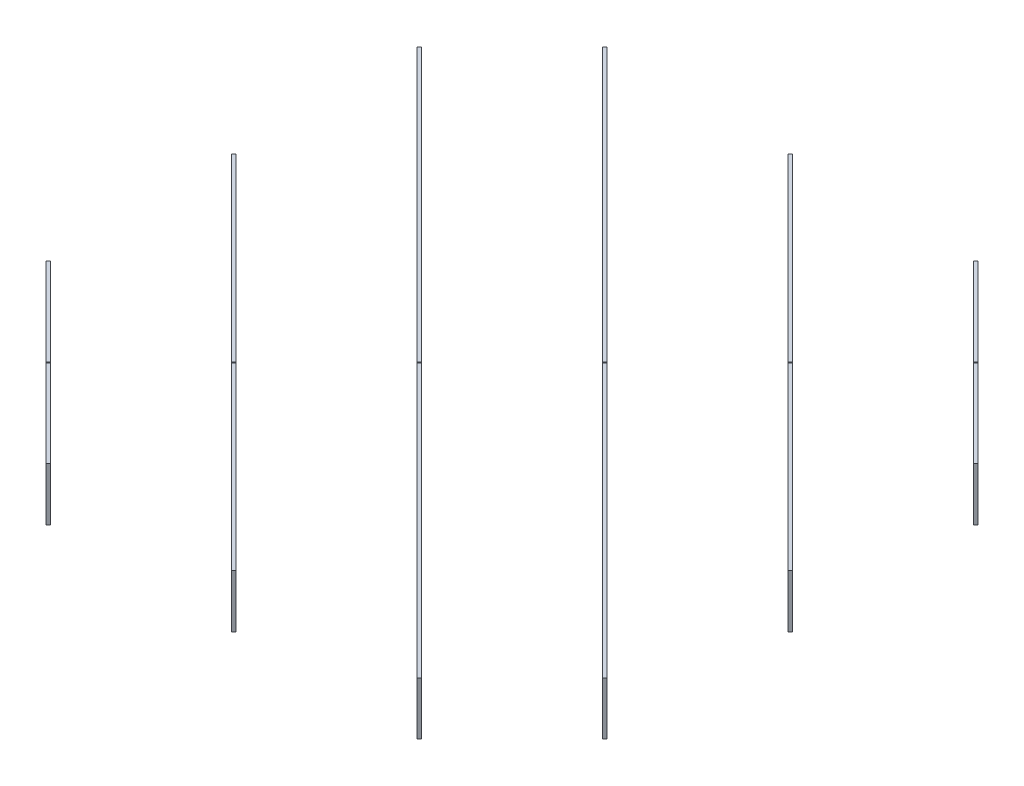
from build123d import *

# Parameters (mm, degrees)
BOSS_EXTRUDE1_DEPTH   = 100
BOSS_EXTRUDE1_2_DEPTH = 100
BOSS_EXTRUDE1_3_DEPTH = 100
BOSS_EXTRUDE1_4_DEPTH = 100
BOSS_EXTRUDE1_5_DEPTH = 100
BOSS_EXTRUDE1_6_DEPTH = 100
SKETCH3_R             = 1.5
SKETCH3_W             = 6
SKETCH3_H             = 100
CUT_EXTRUDE1_DEPTH    = 1481.698283187
SKETCH4_W             = 56
SKETCH4_H             = 12
CUT_EXTRUDE2_DEPTH    = 6
SKETCH5_W             = 56
SKETCH5_H             = 12
CUT_EXTRUDE3_DEPTH    = 6
SKETCH6_R             = 1.5
CUT_EXTRUDE4_DEPTH    = 1481.698283187
CUT_EXTRUDE5_START    = -253.487374
SKETCH7_R             = 4
CUT_EXTRUDE5_DEPTH    = 253.487374
CUT_EXTRUDE6_START    = -253.487374
SKETCH8_R             = 3
CUT_EXTRUDE6_DEPTH    = 253.487374
SKETCH9_R             = 3
CUT_EXTRUDE7_DEPTH    = 253.487373415
CUT_EXTRUDE8_START    = -748.46212
SKETCH10_R            = 3
CUT_EXTRUDE8_DEPTH    = 748.46212
CUT_EXTRUDE9_START    = -253.487374
SKETCH11_R            = 3
CUT_EXTRUDE9_DEPTH    = 253.487374


with BuildPart() as part:
    # Sketch2 → Boss-Extrude1 (new body)
    with BuildSketch(Plane(origin=(0, 0, 0), x_dir=(1, 0, 0), z_dir=(0, 1, 0))):
        Polygon((-605, -274.242640687), (-274.242640687, -605), (-270, -600.757359313), (-600.757359313, -270), align=None)
    extrude(amount=BOSS_EXTRUDE1_DEPTH)


with BuildPart() as body_2:
    # Sketch2 → Boss-Extrude1 2 (new body)
    with BuildSketch(Plane(origin=(0, 0, 0), x_dir=(1, 0, 0), z_dir=(0, 1, 0))):
        Polygon((-605, 75.757359313), (75.757359313, -605), (80, -600.757359313), (-600.757359313, 80), align=None)
    extrude(amount=BOSS_EXTRUDE1_2_DEPTH)


with BuildPart() as body_3:
    # Sketch2 → Boss-Extrude1 3 (new body)
    with BuildSketch(Plane(origin=(0, 0, 0), x_dir=(1, 0, 0), z_dir=(0, 1, 0))):
        Polygon((-605, 425.757359313), (425.757359313, -605), (430, -600.757359313), (-600.757359313, 430), align=None)
    extrude(amount=BOSS_EXTRUDE1_3_DEPTH)


with BuildPart() as body_4:
    # Sketch2 → Boss-Extrude1 4 (new body)
    with BuildSketch(Plane(origin=(0, 0, 0), x_dir=(1, 0, 0), z_dir=(0, 1, 0))):
        Polygon((-430, 600.757359313), (600.757359313, -430), (605, -425.757359313), (-425.757359313, 605), align=None)
    extrude(amount=BOSS_EXTRUDE1_4_DEPTH)


with BuildPart() as body_5:
    # Sketch2 → Boss-Extrude1 5 (new body)
    with BuildSketch(Plane(origin=(0, 0, 0), x_dir=(1, 0, 0), z_dir=(0, 1, 0))):
        Polygon((-80, 600.757359313), (600.757359313, -80), (605, -75.757359313), (-75.757359313, 605), align=None)
    extrude(amount=BOSS_EXTRUDE1_5_DEPTH)


with BuildPart() as body_6:
    # Sketch2 → Boss-Extrude1 6 (new body)
    with BuildSketch(Plane(origin=(0, 0, 0), x_dir=(1, 0, 0), z_dir=(0, 1, 0))):
        Polygon((270, 600.757359313), (600.757359313, 270), (605, 274.242640687), (274.242640687, 605), align=None)
    extrude(amount=BOSS_EXTRUDE1_6_DEPTH)


with BuildPart() as cut_extrude1_tool:
    # Sketch3 → Cut-Extrude1 (new, through all)
    with BuildSketch(Plane(origin=(-439.621320344, 0, 439.621320344), x_dir=(0.7071067811865451, 0, 0.70710678118655), z_dir=(-0.70710678118655, 0, 0.7071067811865451))):
        with Locations((-615.718433538, 50)):
            Circle(SKETCH3_R)
        with Locations((-621.718433538, 50)):
            Circle(SKETCH3_R)
        with Locations((-618.718433538, 0)):
            Rectangle(SKETCH3_W, SKETCH3_H)
        with BuildLine():
            Line((-621.718433538, 48.5), (-621.718433538, 50))
            Line((-621.718433538, 50), (-620.218433538, 50))
            ThreePointArc((-620.218433538, 50), (-622.77909371, 51.060660172), (-621.718433538, 48.5))
        make_face()
        with BuildLine():
            Line((-620.218433538, 50), (-621.718433538, 50))
            Line((-621.718433538, 50), (-621.718433538, 48.5))
            ThreePointArc((-621.718433538, 48.5), (-620.657773366, 48.939339828), (-620.218433538, 50))
        make_face()
        with BuildLine():
            ThreePointArc((-614.218433538, 50), (-615.718433538, 51.5), (-617.218433538, 50))
            Line((-617.218433538, 50), (-615.718433538, 50))
            Line((-615.718433538, 50), (-615.718433538, 48.5))
            ThreePointArc((-615.718433538, 48.5), (-614.657773366, 48.939339828), (-614.218433538, 50))
        make_face()
        with BuildLine():
            Line((-615.718433538, 50), (-617.218433538, 50))
            ThreePointArc((-617.218433538, 50), (-616.77909371, 48.939339828), (-615.718433538, 48.5))
            Line((-615.718433538, 48.5), (-615.718433538, 50))
        make_face()
        with BuildLine():
            Line((-374.231060123, 48.5), (-374.231060123, 50))
            Line((-374.231060123, 50), (-372.731060123, 50))
            ThreePointArc((-372.731060123, 50), (-375.291720295, 51.060660172), (-374.231060123, 48.5))
        make_face()
        with BuildLine():
            Line((-372.731060123, 50), (-374.231060123, 50))
            Line((-374.231060123, 50), (-374.231060123, 48.5))
            ThreePointArc((-374.231060123, 48.5), (-373.170399951, 48.939339828), (-372.731060123, 50))
        make_face()
        with Locations((-368.231060123, 50)):
            Circle(SKETCH3_R)
        with Locations((-374.231060123, 50)):
            Circle(SKETCH3_R)
        with Locations((-371.231060123, 0)):
            Rectangle(SKETCH3_W, SKETCH3_H)
        with BuildLine():
            ThreePointArc((-366.731060123, 50), (-368.231060123, 51.5), (-369.731060123, 50))
            Line((-369.731060123, 50), (-368.231060123, 50))
            Line((-368.231060123, 50), (-368.231060123, 48.5))
            ThreePointArc((-368.231060123, 48.5), (-367.170399951, 48.939339828), (-366.731060123, 50))
        make_face()
        with BuildLine():
            Line((-368.231060123, 50), (-369.731060123, 50))
            ThreePointArc((-369.731060123, 50), (-369.291720295, 48.939339828), (-368.231060123, 48.5))
            Line((-368.231060123, 48.5), (-368.231060123, 50))
        make_face()
        with BuildLine():
            Line((-126.705577884, 48.5), (-126.705577884, 50))
            Line((-126.705577884, 50), (-125.205577884, 50))
            ThreePointArc((-125.205577884, 50), (-127.766238056, 51.060660172), (-126.705577884, 48.5))
        make_face()
        with BuildLine():
            Line((-125.205577884, 50), (-126.705577884, 50))
            Line((-126.705577884, 50), (-126.705577884, 48.5))
            ThreePointArc((-126.705577884, 48.5), (-125.644917713, 48.939339828), (-125.205577884, 50))
        make_face()
        with BuildLine():
            ThreePointArc((-119.205577884, 50), (-120.705577884, 51.5), (-122.205577884, 50))
            Line((-122.205577884, 50), (-120.705577884, 50))
            Line((-120.705577884, 50), (-120.705577884, 48.5))
            ThreePointArc((-120.705577884, 48.5), (-119.644917713, 48.939339828), (-119.205577884, 50))
        make_face()
        with BuildLine():
            Line((-120.705577884, 50), (-122.205577884, 50))
            ThreePointArc((-122.205577884, 50), (-121.766238056, 48.939339828), (-120.705577884, 48.5))
            Line((-120.705577884, 48.5), (-120.705577884, 50))
        make_face()
        with BuildLine():
            Line((-122.205577884, 50), (-125.205577884, 50))
            ThreePointArc((-125.205577884, 50), (-125.644917713, 48.939339828), (-126.705577884, 48.5))
            Line((-126.705577884, 48.5), (-126.705577884, 0))
            Line((-126.705577884, 0), (-120.705577884, 0))
            Line((-120.705577884, 0), (-120.705577884, 48.5))
            ThreePointArc((-120.705577884, 48.5), (-121.766238056, 48.939339828), (-122.205577884, 50))
        make_face()
        with BuildLine():
            ThreePointArc((122.205577884, 50), (119.644917713, 51.060660172), (120.705577884, 48.5))
            Line((120.705577884, 48.5), (120.705577884, 50))
            Line((120.705577884, 50), (122.205577884, 50))
        make_face()
        with BuildLine():
            Line((120.705577884, 50), (120.705577884, 48.5))
            ThreePointArc((120.705577884, 48.5), (121.766238056, 48.939339828), (122.205577884, 50))
            Line((122.205577884, 50), (120.705577884, 50))
        make_face()
        with BuildLine():
            Line((120.705577884, 48.5), (120.705577884, 0))
            Line((120.705577884, 0), (126.705577884, 0))
            Line((126.705577884, 0), (126.705577884, 48.5))
            ThreePointArc((126.705577884, 48.5), (125.644917713, 48.939339828), (125.205577884, 50))
            Line((125.205577884, 50), (122.205577884, 50))
            ThreePointArc((122.205577884, 50), (121.766238056, 48.939339828), (120.705577884, 48.5))
        make_face()
        with BuildLine():
            ThreePointArc((125.205577884, 50), (125.644917713, 48.939339828), (126.705577884, 48.5))
            Line((126.705577884, 48.5), (126.705577884, 50))
            Line((126.705577884, 50), (125.205577884, 50))
        make_face()
        with BuildLine():
            Line((126.705577884, 50), (126.705577884, 48.5))
            ThreePointArc((126.705577884, 48.5), (127.766238056, 48.939339828), (128.205577884, 50))
            ThreePointArc((128.205577884, 50), (126.705577884, 51.5), (125.205577884, 50))
            Line((125.205577884, 50), (126.705577884, 50))
        make_face()
        with BuildLine():
            Line((369.731060123, 50), (368.231060123, 50))
            Line((368.231060123, 50), (368.231060123, 48.5))
            ThreePointArc((368.231060123, 48.5), (369.291720295, 48.939339828), (369.731060123, 50))
        make_face()
        with BuildLine():
            Line((368.231060123, 48.5), (368.231060123, 50))
            Line((368.231060123, 50), (369.731060123, 50))
            ThreePointArc((369.731060123, 50), (367.170399951, 51.060660172), (368.231060123, 48.5))
        make_face()
        with Locations((374.231060123, 50)):
            Circle(SKETCH3_R)
        with Locations((368.231060123, 50)):
            Circle(SKETCH3_R)
        with Locations((371.231060123, 0)):
            Rectangle(SKETCH3_W, SKETCH3_H)
        with BuildLine():
            ThreePointArc((375.731060123, 50), (374.231060123, 51.5), (372.731060123, 50))
            Line((372.731060123, 50), (374.231060123, 50))
            Line((374.231060123, 50), (374.231060123, 48.5))
            ThreePointArc((374.231060123, 48.5), (375.291720295, 48.939339828), (375.731060123, 50))
        make_face()
        with BuildLine():
            Line((374.231060123, 50), (372.731060123, 50))
            ThreePointArc((372.731060123, 50), (373.170399951, 48.939339828), (374.231060123, 48.5))
            Line((374.231060123, 48.5), (374.231060123, 50))
        make_face()
        with BuildLine():
            Line((617.218433538, 50), (615.718433538, 50))
            Line((615.718433538, 50), (615.718433538, 48.5))
            ThreePointArc((615.718433538, 48.5), (616.77909371, 48.939339828), (617.218433538, 50))
        make_face()
        with BuildLine():
            Line((615.718433538, 48.5), (615.718433538, 50))
            Line((615.718433538, 50), (617.218433538, 50))
            ThreePointArc((617.218433538, 50), (614.657773366, 51.060660172), (615.718433538, 48.5))
        make_face()
        with BuildLine():
            ThreePointArc((623.218433538, 50), (621.718433538, 51.5), (620.218433538, 50))
            Line((620.218433538, 50), (621.718433538, 50))
            Line((621.718433538, 50), (621.718433538, 48.5))
            ThreePointArc((621.718433538, 48.5), (622.77909371, 48.939339828), (623.218433538, 50))
        make_face()
        with BuildLine():
            Line((621.718433538, 50), (620.218433538, 50))
            ThreePointArc((620.218433538, 50), (620.657773366, 48.939339828), (621.718433538, 48.5))
            Line((621.718433538, 48.5), (621.718433538, 50))
        make_face()
        with Locations((621.718433538, 50)):
            Circle(SKETCH3_R)
        with Locations((615.718433538, 50)):
            Circle(SKETCH3_R)
        with Locations((618.718433538, 0)):
            Rectangle(SKETCH3_W, SKETCH3_H)
    extrude(amount=-CUT_EXTRUDE1_DEPTH)


with BuildPart() as part_1:
    add(part.part)

    # Cut-Extrude1: cut by cut_extrude1_tool
    add(cut_extrude1_tool.part, mode=Mode.SUBTRACT)


with BuildPart() as body_2_1:
    add(body_2.part)

    # Cut-Extrude1: cut by cut_extrude1_tool
    add(cut_extrude1_tool.part, mode=Mode.SUBTRACT)

    # Sketch5 → Cut-Extrude3 (cut)
    with BuildSketch(Plane(origin=(-264.621320344, 0, 264.621320344), x_dir=(0.7071067811865479, 0, 0.7071067811865472), z_dir=(-0.7071067811865472, 0, 0.7071067811865479))):
        with Locations((0.019054412, 22)):
            Rectangle(SKETCH5_W, SKETCH5_H)
    extrude(amount=-CUT_EXTRUDE3_DEPTH, mode=Mode.SUBTRACT)


with BuildPart() as body_3_1:
    add(body_3.part)

    # Cut-Extrude1: cut by cut_extrude1_tool
    add(cut_extrude1_tool.part, mode=Mode.SUBTRACT)


with BuildPart() as body_4_1:
    add(body_4.part)

    # Cut-Extrude1: cut by cut_extrude1_tool
    add(cut_extrude1_tool.part, mode=Mode.SUBTRACT)


with BuildPart() as body_5_1:
    add(body_5.part)

    # Cut-Extrude1: cut by cut_extrude1_tool
    add(cut_extrude1_tool.part, mode=Mode.SUBTRACT)

    # Sketch4 → Cut-Extrude2 (cut)
    with BuildSketch(Plane(origin=(260.378679656, 0, -260.378679656), x_dir=(0.7071067811865479, 0, 0.7071067811865472), z_dir=(-0.7071067811865472, 0, 0.7071067811865479))):
        with Locations((0.019054412, 22)):
            Rectangle(SKETCH4_W, SKETCH4_H)
    extrude(amount=-CUT_EXTRUDE2_DEPTH, mode=Mode.SUBTRACT)


with BuildPart() as body_6_1:
    add(body_6.part)

    # Cut-Extrude1: cut by cut_extrude1_tool
    add(cut_extrude1_tool.part, mode=Mode.SUBTRACT)


with BuildPart() as cut_extrude4_tool:
    # Sketch6 → Cut-Extrude4 (new, through all)
    with BuildSketch(Plane(origin=(-439.621320344, 0, 439.621320344), x_dir=(0.7071067811865468, 0, 0.7071067811865482), z_dir=(-0.7071067811865482, 0, 0.7071067811865468))):
        with Locations((0, 100)):
            Circle(SKETCH6_R)
    extrude(amount=-CUT_EXTRUDE4_DEPTH)


with BuildPart() as part_2:
    add(part_1.part)

    # Cut-Extrude4: cut by cut_extrude4_tool
    add(cut_extrude4_tool.part, mode=Mode.SUBTRACT)


with BuildPart() as body_2_2:
    add(body_2_1.part)

    # Cut-Extrude4: cut by cut_extrude4_tool
    add(cut_extrude4_tool.part, mode=Mode.SUBTRACT)


with BuildPart() as body_3_2:
    add(body_3_1.part)

    # Cut-Extrude4: cut by cut_extrude4_tool
    add(cut_extrude4_tool.part, mode=Mode.SUBTRACT)


with BuildPart() as body_4_2:
    add(body_4_1.part)

    # Cut-Extrude4: cut by cut_extrude4_tool
    add(cut_extrude4_tool.part, mode=Mode.SUBTRACT)


with BuildPart() as body_5_2:
    add(body_5_1.part)

    # Cut-Extrude4: cut by cut_extrude4_tool
    add(cut_extrude4_tool.part, mode=Mode.SUBTRACT)


with BuildPart() as body_6_2:
    add(body_6_1.part)

    # Cut-Extrude4: cut by cut_extrude4_tool
    add(cut_extrude4_tool.part, mode=Mode.SUBTRACT)


with BuildPart() as cut_extrude5_tool:
    # Sketch7 → Cut-Extrude5 (new body)
    with BuildSketch(Plane(origin=(-89.621320344, 0, 89.621320344), x_dir=(0.7071067811865432, 0, 0.7071067811865519), z_dir=(-0.7071067811865519, 0, 0.7071067811865432)).offset(CUT_EXTRUDE5_START)):
        with Locations((0, 84)):
            Circle(SKETCH7_R)
        with Locations((0, 64)):
            Circle(SKETCH7_R)
    extrude(amount=CUT_EXTRUDE5_DEPTH)


with BuildPart() as body_3_3:
    add(body_3_2.part)

    # Cut-Extrude5: cut by cut_extrude5_tool
    add(cut_extrude5_tool.part, mode=Mode.SUBTRACT)


with BuildPart() as body_4_3:
    add(body_4_2.part)

    # Cut-Extrude5: cut by cut_extrude5_tool
    add(cut_extrude5_tool.part, mode=Mode.SUBTRACT)


with BuildPart() as cut_extrude6_tool:
    # Sketch8 → Cut-Extrude6 (new body)
    with BuildSketch(Plane(origin=(-439.621320344, 0, 439.621320344), x_dir=(0.7071067811865468, 0, 0.7071067811865482), z_dir=(-0.7071067811865482, 0, 0.7071067811865468)).offset(CUT_EXTRUDE6_START)):
        with Locations((0, 50)):
            Circle(SKETCH8_R)
    extrude(amount=CUT_EXTRUDE6_DEPTH)


with BuildPart() as part_3:
    add(part_2.part)

    # Cut-Extrude6: cut by cut_extrude6_tool
    add(cut_extrude6_tool.part, mode=Mode.SUBTRACT)


with BuildPart() as body_2_3:
    add(body_2_2.part)

    # Cut-Extrude6: cut by cut_extrude6_tool
    add(cut_extrude6_tool.part, mode=Mode.SUBTRACT)


with BuildPart() as cut_extrude7_tool:
    # Sketch9 → Cut-Extrude7 (new body)
    with BuildSketch(Plane(origin=(439.621320344, 0, -439.621320344), x_dir=(-0.7071067811865479, 0, -0.7071067811865472), z_dir=(0.7071067811865472, 0, -0.7071067811865479))):
        with Locations((0, 50)):
            Circle(SKETCH9_R)
    extrude(amount=-CUT_EXTRUDE7_DEPTH)


with BuildPart() as body_5_3:
    add(body_5_2.part)

    # Cut-Extrude7: cut by cut_extrude7_tool
    add(cut_extrude7_tool.part, mode=Mode.SUBTRACT)


with BuildPart() as body_6_3:
    add(body_6_2.part)

    # Cut-Extrude7: cut by cut_extrude7_tool
    add(cut_extrude7_tool.part, mode=Mode.SUBTRACT)


with BuildPart() as cut_extrude8_tool:
    # Sketch10 → Cut-Extrude8 (new body)
    with BuildSketch(Plane(origin=(-264.621320344, 0, 264.621320344), x_dir=(0.7071067811865479, 0, 0.7071067811865472), z_dir=(-0.7071067811865472, 0, 0.7071067811865479)).offset(CUT_EXTRUDE8_START)):
        with Locations((-247.477846209, 50)):
            Circle(SKETCH10_R)
    cut_extrude8 = extrude(amount=CUT_EXTRUDE8_DEPTH)


with BuildPart() as body_2_4:
    add(body_2_3.part)

    # Cut-Extrude8: cut by cut_extrude8_tool
    add(cut_extrude8_tool.part, mode=Mode.SUBTRACT)


with BuildPart() as body_3_4:
    add(body_3_3.part)

    # Cut-Extrude8: cut by cut_extrude8_tool
    add(cut_extrude8_tool.part, mode=Mode.SUBTRACT)


with BuildPart() as body_4_4:
    add(body_4_3.part)

    # Cut-Extrude8: cut by cut_extrude8_tool
    add(cut_extrude8_tool.part, mode=Mode.SUBTRACT)


with BuildPart() as body_5_4:
    add(body_5_3.part)

    # Cut-Extrude8: cut by cut_extrude8_tool
    add(cut_extrude8_tool.part, mode=Mode.SUBTRACT)


with BuildPart() as cut_extrude9_tool:
    # Sketch11 → Cut-Extrude9 (new body)
    with BuildSketch(Plane(origin=(-89.621320344, 0, 89.621320344), x_dir=(0.7071067811865432, 0, 0.7071067811865519), z_dir=(-0.7071067811865519, 0, 0.7071067811865432)).offset(CUT_EXTRUDE9_START)):
        with Locations((-494.974746831, 50)):
            Circle(SKETCH11_R)
    cut_extrude9 = extrude(amount=CUT_EXTRUDE9_DEPTH)


with BuildPart() as body_3_5:
    add(body_3_4.part)

    # Cut-Extrude9: cut by cut_extrude9_tool
    add(cut_extrude9_tool.part, mode=Mode.SUBTRACT)


with BuildPart() as body_4_5:
    add(body_4_4.part)

    # Cut-Extrude9: cut by cut_extrude9_tool
    add(cut_extrude9_tool.part, mode=Mode.SUBTRACT)


with BuildPart() as mirror1_tool:
    # Mirror1: Cut-Extrude8, Cut-Extrude9 across plane
    add(cut_extrude8.mirror(Plane(origin=(0, 0, 0), x_dir=(-0.7071067811865472, 0, 0.7071067811865479), z_dir=(-0.7071067811865478, 0, -0.7071067811865472))))
    add(cut_extrude9.mirror(Plane(origin=(0, 0, 0), x_dir=(-0.7071067811865472, 0, 0.7071067811865479), z_dir=(-0.7071067811865478, 0, -0.7071067811865472))))


with BuildPart() as body_2_5:
    add(body_2_4.part)

    # Mirror1: cut by mirror1_tool
    add(mirror1_tool.part, mode=Mode.SUBTRACT)


with BuildPart() as body_3_6:
    add(body_3_5.part)

    # Mirror1: cut by mirror1_tool
    add(mirror1_tool.part, mode=Mode.SUBTRACT)


with BuildPart() as body_4_6:
    add(body_4_5.part)

    # Mirror1: cut by mirror1_tool
    add(mirror1_tool.part, mode=Mode.SUBTRACT)


with BuildPart() as body_5_5:
    add(body_5_4.part)

    # Mirror1: cut by mirror1_tool
    add(mirror1_tool.part, mode=Mode.SUBTRACT)


solid = Compound([part_3.part, body_6_3.part, body_2_5.part, body_3_6.part, body_4_6.part, body_5_5.part])
